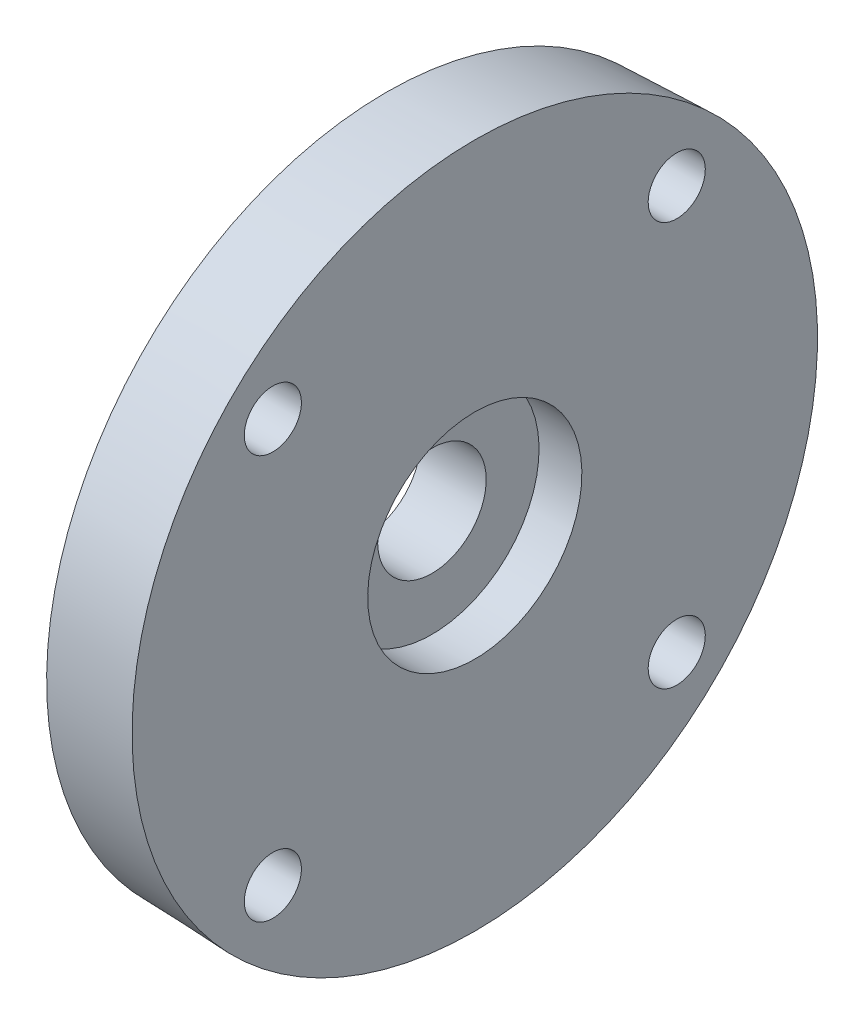
from build123d import *

# Parameters (mm, degrees)
SKETCH2_R          = 2.54
CUT_EXTRUDE1_DEPTH = 44.818496962
SKETCH3_R          = 9.525
CUT_EXTRUDE2_DEPTH = 3.81


with BuildPart() as part:
    # Sketch1 → Revolve1 (revolve)
    with BuildSketch(Plane.XY):
        Polygon((-7.874, 8.255), (-7.874, 30.205033861), (0, 30.48), (0, 4.826), (-9.652, 4.826), (-9.652, 8.255), align=None)
    revolve(axis=Axis((0, 0, 0), (-1, 0, 0)))

    # Sketch2 → Cut-Extrude1 (cut, through all)
    with BuildSketch(Plane.ZY.offset(7.874)):
        with Locations(Location((-17.960512242, 17.960512242, 0), (0, 0, 270))):
            Circle(SKETCH2_R)
        with Locations(Location((17.960512242, 17.960512242, 0), (0, 0, 270))):
            Circle(SKETCH2_R)
        with Locations(Location((17.960512242, -17.960512242, 0), (0, 0, 270))):
            Circle(SKETCH2_R)
        with Locations(Location((-17.960512242, -17.960512242, 0), (0, 0, 270))):
            Circle(SKETCH2_R)
    extrude(amount=-CUT_EXTRUDE1_DEPTH, mode=Mode.SUBTRACT)

    # Sketch3 → Cut-Extrude2 (cut)
    with BuildSketch(Plane(origin=(0, 0, 0), x_dir=(0, 0, -1), z_dir=(1, 0, 0))):
        with Locations(Location((0, 0, 0), (0, 0, 90))):
            Circle(SKETCH3_R)
    extrude(amount=-CUT_EXTRUDE2_DEPTH, mode=Mode.SUBTRACT)


solid = part.part
